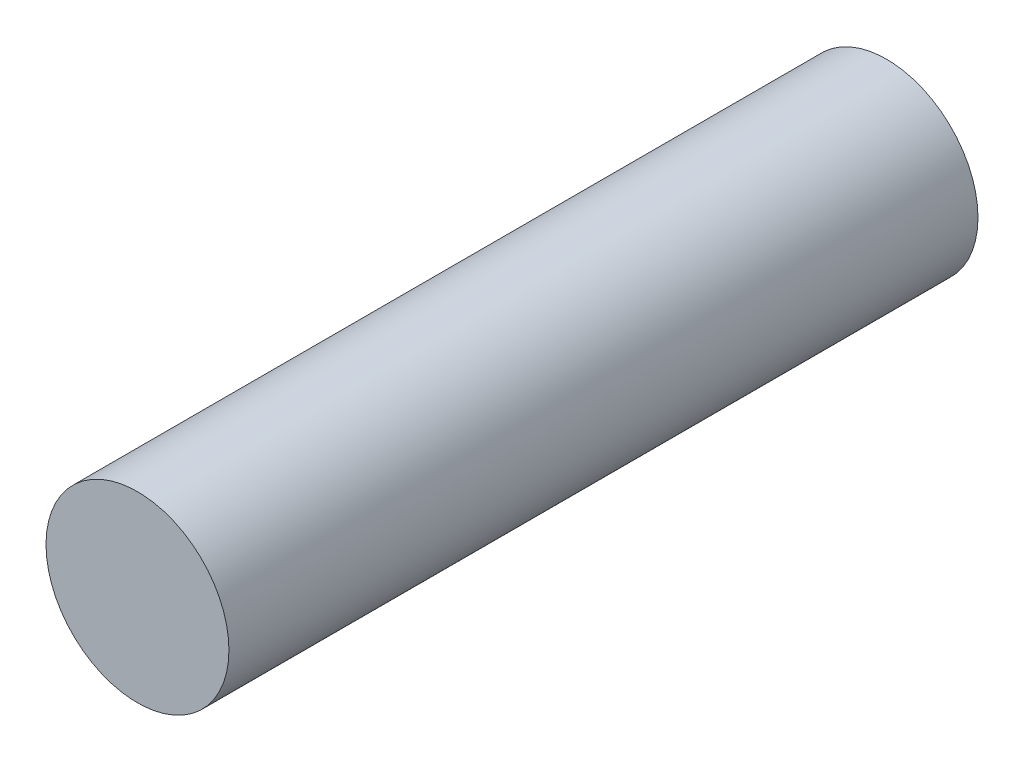
from build123d import *

# Parameters (mm, degrees)
SKETCH1_R           = 3.175
BOSS_EXTRUDE1_DEPTH = 26.000659267


with BuildPart() as part:
    # Sketch1 → Boss-Extrude1 (new body)
    with BuildSketch(Plane.XY):
        Circle(SKETCH1_R)
    extrude(amount=BOSS_EXTRUDE1_DEPTH)


solid = part.part
